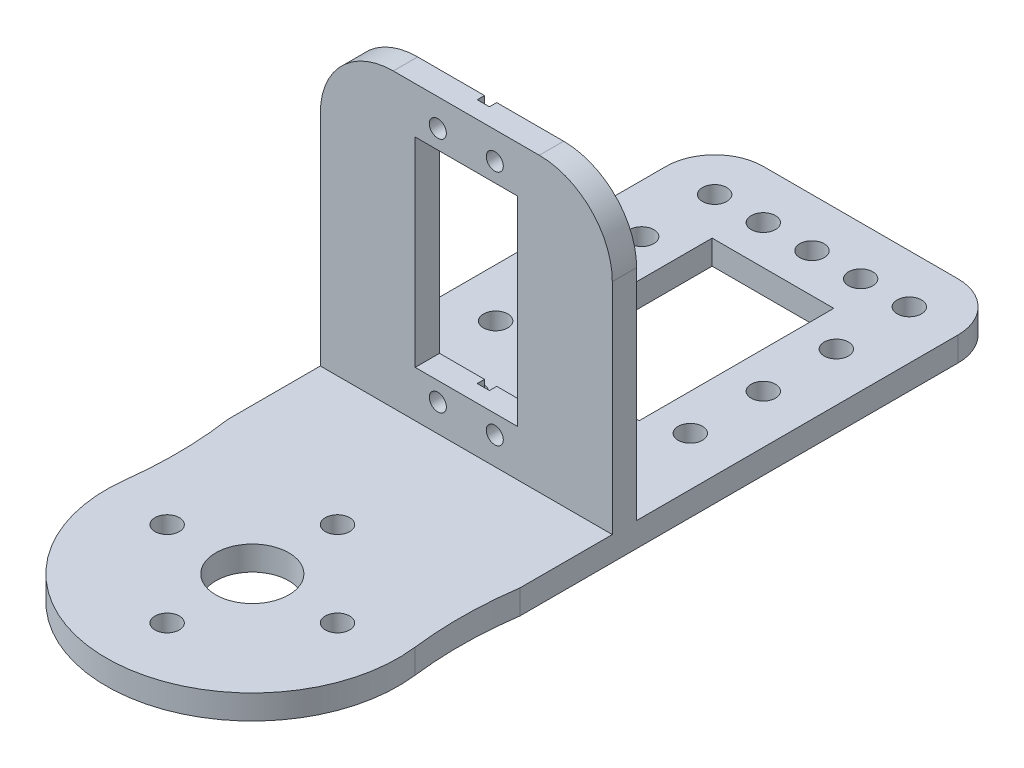
from build123d import *

# Parameters (mm, degrees)
SKETCH1_W           = 60
SKETCH1_H           = 100
BOSS_EXTRUDE1_DEPTH = 5
SKETCH2_R           = 2.5
CUT_EXTRUDE1_DEPTH  = 5
BOSS_EXTRUDE2_DEPTH = 5
SKETCH6_R           = 7.5
CUT_EXTRUDE3_DEPTH  = 5
SKETCH7_W           = 60
SKETCH7_H           = 5
BOSS_EXTRUDE3_DEPTH = 60
SKETCH8_R           = 1.75
SKETCH8_W           = 21
SKETCH8_H           = 41
CUT_EXTRUDE5_DEPTH  = 30
FILLET1_R           = 15
SKETCH13_R          = 2.5
CUT_EXTRUDE7_DEPTH  = 10
SKETCH15_R          = 2.5
CUT_EXTRUDE8_DEPTH  = 10
SKETCH16_W          = 25
SKETCH16_H          = 40
CUT_EXTRUDE9_DEPTH  = 10
FILLET3_R           = 10
SKETCH17_R          = 2.5
CUT_EXTRUDE10_DEPTH = 10
SKETCH18_W          = 2.5
SKETCH18_H          = 10
CUT_EXTRUDE11_DEPTH = 1.5


with BuildPart() as part:
    # Sketch1 → Boss-Extrude1 (new body)
    with BuildSketch(Plane(origin=(0, 0, 0), x_dir=(1, 0, 0), z_dir=(0, 1, 0))):
        Rectangle(SKETCH1_W, SKETCH1_H)
    extrude(amount=BOSS_EXTRUDE1_DEPTH)

    # Sketch2 → Cut-Extrude1 (cut)
    with BuildSketch(Plane(origin=(0, 5, 0), x_dir=(1, 0, 0), z_dir=(0, 1, 0))):
        with Locations((0, 40)):
            Circle(SKETCH2_R)
        with Locations((10, 40)):
            Circle(SKETCH2_R)
        with Locations((20, 40)):
            Circle(SKETCH2_R)
        with Locations((-20, 40)):
            Circle(SKETCH2_R)
        with Locations((-10, 40)):
            Circle(SKETCH2_R)
    extrude(amount=-CUT_EXTRUDE1_DEPTH, mode=Mode.SUBTRACT)

    # Sketch5 → Boss-Extrude2 (add)
    with BuildSketch(Plane(origin=(0, 5, 0), x_dir=(1, 0, 0), z_dir=(0, 1, 0))):
        with BuildLine():
            Line((-16.583123952, -50), (-30, -50))
            ThreePointArc((-30, -50), (-29.173280954, -60.651847283), (-29.77329768, -71.318866307))
            ThreePointArc((-29.77329768, -71.318866307), (0, -105), (29.77329768, -71.318866307))
            ThreePointArc((29.77329768, -71.318866307), (29.173280954, -60.651847283), (30, -50))
            Line((30, -50), (16.583123952, -50))
            ThreePointArc((16.583123952, -50), (0, -45), (-16.583123952, -50))
        make_face()
    extrude(amount=-BOSS_EXTRUDE2_DEPTH)

    # Sketch6 → Cut-Extrude3 (cut)
    with BuildSketch(Plane(origin=(0, 5, 0), x_dir=(1, 0, 0), z_dir=(0, 1, 0))):
        with Locations((0, -75)):
            Circle(SKETCH6_R)
    extrude(amount=-CUT_EXTRUDE3_DEPTH, mode=Mode.SUBTRACT)

    # Sketch7 → Boss-Extrude3 (add)
    with BuildSketch(Plane(origin=(0, 5, 0), x_dir=(1, 0, 0), z_dir=(0, 1, 0))):
        with Locations((0, -28.53)):
            Rectangle(SKETCH7_W, SKETCH7_H)
    extrude(amount=BOSS_EXTRUDE3_DEPTH)

    # Sketch8 → Cut-Extrude5 (cut)
    with BuildSketch(Plane.XY.offset(31.03)):
        with Locations((-5.85, 59.35)):
            Circle(SKETCH8_R)
        with Locations((5.85, 59.35)):
            Circle(SKETCH8_R)
        with Locations((5.85, 10.65)):
            Circle(SKETCH8_R)
        with Locations((-5.85, 10.65)):
            Circle(SKETCH8_R)
        with Locations((0, 35)):
            Rectangle(SKETCH8_W, SKETCH8_H)
    extrude(amount=-CUT_EXTRUDE5_DEPTH, mode=Mode.SUBTRACT)

    # Fillet1
    fillet1_edges = [part.edges().sort_by_distance(p)[0] for p in [
        (30, 65, 28.53),
        (-30, 65, 28.53),
    ]]
    fillet(fillet1_edges, radius=FILLET1_R)

    # Sketch13 → Cut-Extrude7 (cut)
    with BuildSketch(Plane(origin=(0, 5, 0), x_dir=(1, 0, 0), z_dir=(0, 1, 0))):
        with Locations((-20, 25)):
            Circle(SKETCH13_R)
        with Locations((-20, 10)):
            Circle(SKETCH13_R)
        with Locations((-20, -5)):
            Circle(SKETCH13_R)
        with Locations((20, -5)):
            Circle(SKETCH13_R)
        with Locations((20, 10)):
            Circle(SKETCH13_R)
        with Locations((20, 25)):
            Circle(SKETCH13_R)
    extrude(amount=-CUT_EXTRUDE7_DEPTH, mode=Mode.SUBTRACT)

    # Sketch15 → Cut-Extrude8 (cut)
    with BuildSketch(Plane(origin=(0, 5, 0), x_dir=(1, 0, 0), z_dir=(0, 1, 0))):
        with Locations((-20, -20)):
            Circle(SKETCH15_R)
        with Locations((-10, -20)):
            Circle(SKETCH15_R)
        with Locations((0, -20)):
            Circle(SKETCH15_R)
        with Locations((10, -20)):
            Circle(SKETCH15_R)
        with Locations((20, -20)):
            Circle(SKETCH15_R)
    extrude(amount=-CUT_EXTRUDE8_DEPTH, mode=Mode.SUBTRACT)

    # Sketch16 → Cut-Extrude9 (cut)
    with BuildSketch(Plane(origin=(0, 5, 0), x_dir=(1, 0, 0), z_dir=(0, 1, 0))):
        with Locations((0, 11.985)):
            Rectangle(SKETCH16_W, SKETCH16_H)
    extrude(amount=-CUT_EXTRUDE9_DEPTH, mode=Mode.SUBTRACT)

    # Fillet3
    fillet3_edges = [part.edges().sort_by_distance(p)[0] for p in [
        (30, 2.5, -50),
        (-30, 2.5, -50),
    ]]
    fillet(fillet3_edges, radius=FILLET3_R)

    # Sketch17 → Cut-Extrude10 (cut)
    with BuildSketch(Plane(origin=(0, 5, 0), x_dir=(1, 0, 0), z_dir=(0, 1, 0))):
        with Locations((0, -57.5)):
            Circle(SKETCH17_R)
        with Locations((17.5, -75)):
            Circle(SKETCH17_R)
        with Locations((0, -92.5)):
            Circle(SKETCH17_R)
        with Locations((-17.5, -75)):
            Circle(SKETCH17_R)
    extrude(amount=-CUT_EXTRUDE10_DEPTH, mode=Mode.SUBTRACT)

    # Sketch18 → Cut-Extrude11 (cut)
    with BuildSketch(Plane(origin=(0, 0, 26.03), x_dir=(-1, 0, 0), z_dir=(0, 0, -1))):
        with Locations((0, 60)):
            Rectangle(SKETCH18_W, SKETCH18_H)
        with Locations((0, 10)):
            Rectangle(SKETCH18_W, SKETCH18_H)
    extrude(amount=-CUT_EXTRUDE11_DEPTH, mode=Mode.SUBTRACT)


solid = part.part
